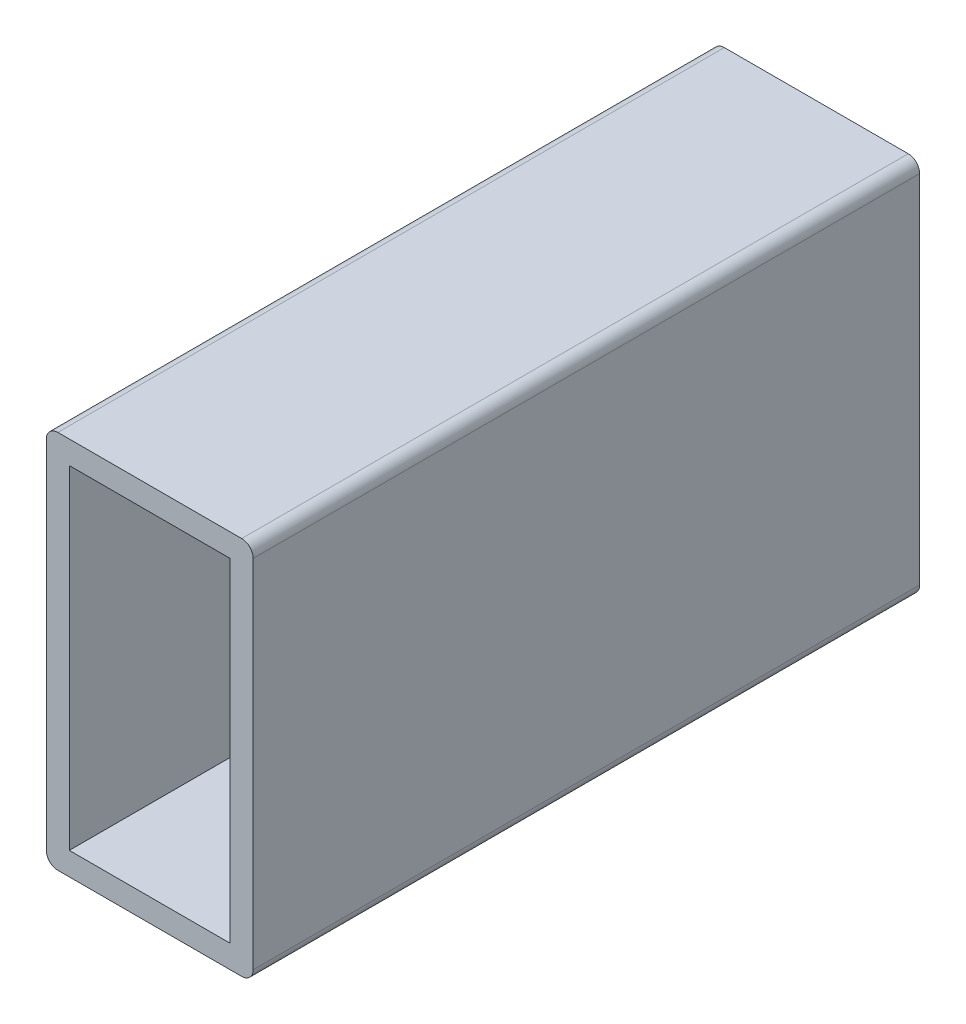
from build123d import *

# Parameters (mm, degrees)
SKETCH_1_W          = 90
SKETCH_1_H          = 165
EXTRUDE_1_DEPTH     = 290
SHELL_1_T           = -10
FILLET_1_R          = 5
CUT_EXTRUDE_1_REACH = 347.579
SKETCH_2_R          = 15


with BuildPart() as part:
    # 스케치1 → 보스-돌출1 (new body)
    with BuildSketch(Plane.XY):
        with Locations((45, 82.5)):
            Rectangle(SKETCH_1_W, SKETCH_1_H)
    extrude(amount=EXTRUDE_1_DEPTH)

    # 쉘1
    shell_1_openings = [part.faces().sort_by_distance(p)[0] for p in [
        (45, 82.5, 290),
    ]]
    offset(amount=SHELL_1_T, openings=shell_1_openings, kind=Kind.INTERSECTION)

    # 필렛1
    fillet_1_edges = [part.edges().sort_by_distance(p)[0] for p in [
        (0, 165, 145),
        (90, 165, 145),
        (90, 0, 145),
        (0, 0, 145),
    ]]
    fillet(fillet_1_edges, radius=FILLET_1_R)

    # 스케치2 → 컷-돌출1 (cut, up to next)
    with BuildSketch(Plane(origin=(0, 0, 0), x_dir=(-1, 0, 0), z_dir=(0, 0, -1)), mode=Mode.PRIVATE) as cut_extrude_1_sk1:
        with Locations((-45, 82.5)):
            Circle(SKETCH_2_R)
    cut_extrude_1_tool1 = extrude(cut_extrude_1_sk1.sketch, amount=-CUT_EXTRUDE_1_REACH, mode=Mode.PRIVATE) & part.part
    add(cut_extrude_1_tool1.solids().sort_by_distance((45, 82.5, 0))[0], mode=Mode.SUBTRACT)


solid = part.part
